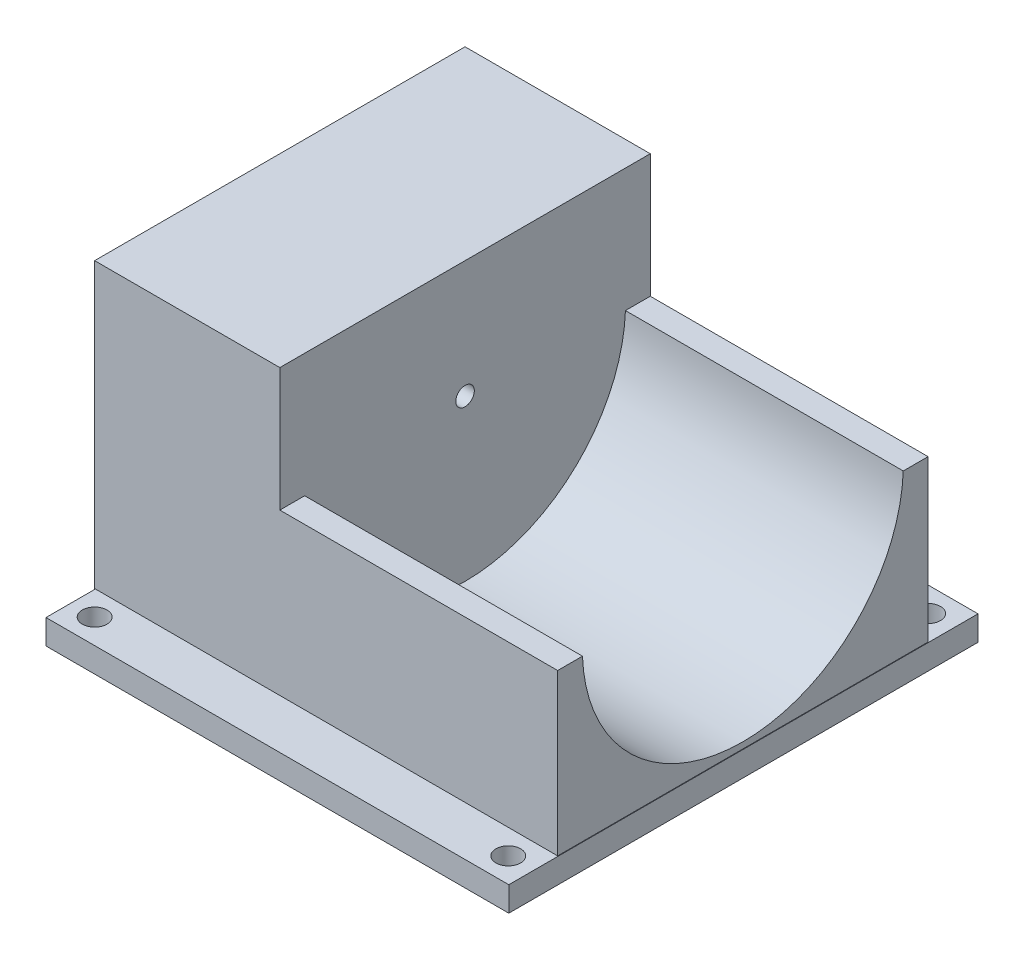
from build123d import *

# Parameters (mm, degrees)
SKETCH1_W           = 30
SKETCH1_H           = 60
BOSS_EXTRUDE1_DEPTH = 50
BOSS_EXTRUDE2_DEPTH = 45
SKETCH3_W           = 74.963778589
SKETCH3_H           = 76
SKETCH3_R           = 2
BOSS_EXTRUDE3_DEPTH = 4
SKETCH4_R           = 1.5
CUT_EXTRUDE1_DEPTH  = 5


with BuildPart() as part:
    # Sketch1 → Boss-Extrude1 (new body)
    with BuildSketch(Plane(origin=(0, 0, 0), x_dir=(1, 0, 0), z_dir=(0, 1, 0))):
        Rectangle(SKETCH1_W, SKETCH1_H)
    extrude(amount=BOSS_EXTRUDE1_DEPTH)

    # Sketch2 → Boss-Extrude2 (add)
    with BuildSketch(Plane(origin=(15, 0, 0), x_dir=(0, 0, -1), z_dir=(1, 0, 0))):
        with BuildLine():
            Line((-25.98102227, 30.006782085), (-30, 30.006782085))
            Line((-30, 30.006782085), (-30, 0))
            Line((-30, 0), (30, 0))
            Line((30, 0), (30, 30.006782085))
            Line((30, 30.006782085), (25.98102227, 30.006782085))
            ThreePointArc((25.98102227, 30.006782085), (0, 5), (-25.98102227, 30.006782085))
        make_face()
    extrude(amount=BOSS_EXTRUDE2_DEPTH)

    # Sketch3 → Boss-Extrude3 (add)
    with BuildSketch(Plane.XZ):
        with Locations((22.604342162, 0)):
            Rectangle(SKETCH3_W, SKETCH3_H)
        with Locations(Location((-11, 34, 0), (0, 0, 270))):
            Circle(SKETCH3_R, mode=Mode.SUBTRACT)
        with Locations(Location((56, 34, 0), (0, 0, 270))):
            Circle(SKETCH3_R, mode=Mode.SUBTRACT)
        with Locations(Location((56, -34, 0), (0, 0, 270))):
            Circle(SKETCH3_R, mode=Mode.SUBTRACT)
        with Locations(Location((-11, -34, 0), (0, 0, 270))):
            Circle(SKETCH3_R, mode=Mode.SUBTRACT)
    extrude(amount=-BOSS_EXTRUDE3_DEPTH)

    # Sketch4 → Cut-Extrude1 (cut)
    with BuildSketch(Plane(origin=(15, 0, 0), x_dir=(0, 0, -1), z_dir=(1, 0, 0))):
        with Locations((0, 31)):
            Circle(SKETCH4_R)
    extrude(amount=-CUT_EXTRUDE1_DEPTH, mode=Mode.SUBTRACT)


solid = part.part
